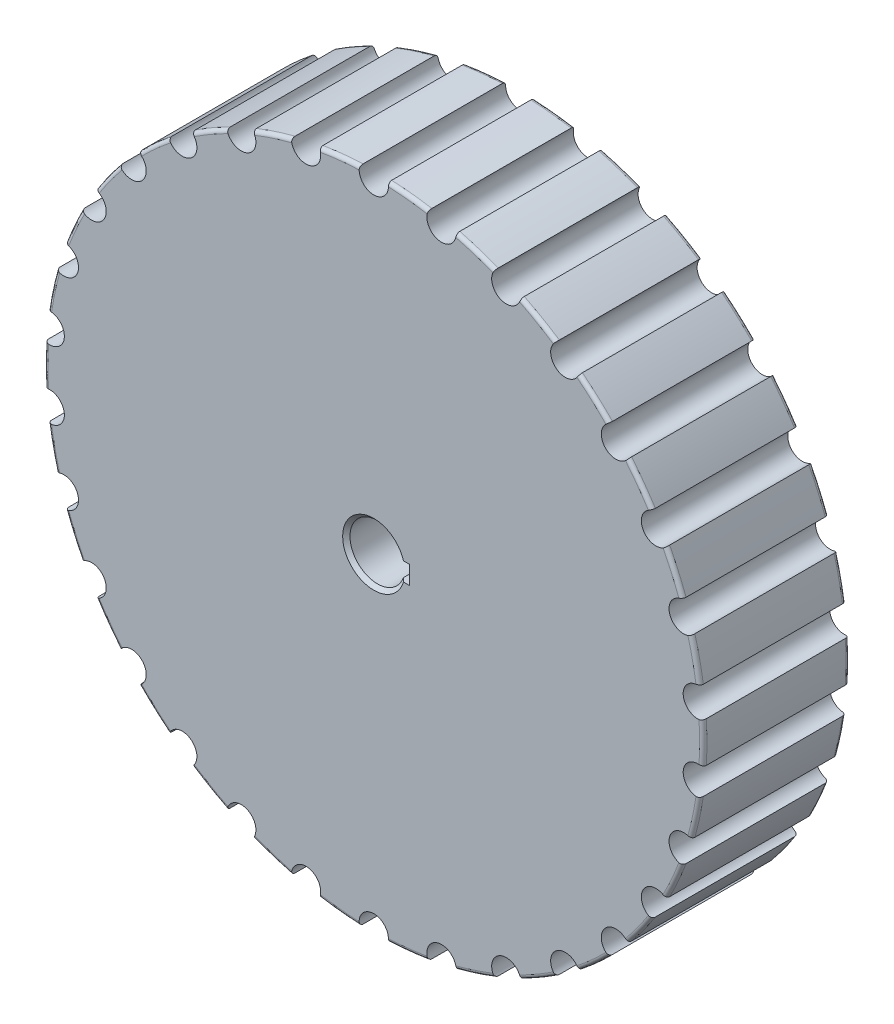
from build123d import *

# Parameters (mm, degrees)
SKETCH_1_W                  = 90
SKETCH_1_H                  = 40
HOLE_WIZARD_1_D             = 150
HOLE_WIZARD_1_DEPTH         = 16
SKETCH_4_R                  = 30
EXTRUDE_1_DEPTH             = 16
CUT_EXTRUDE_1_DEPTH         = 28
HOLE_WIZARD_8_0_8_1_D       = 8
HOLE_WIZARD_8_0_8_2_D       = 8
HOLE_WIZARD_3_3_3_3_1_D     = 3.3
HOLE_WIZARD_3_3_3_3_1_DEPTH = 4
CHAMFER_1_SIZE2             = 0.999999017
CHAMFER_1_SIZE              = 0.999998949
FILLET_1_R                  = 1


with BuildPart() as part:
    # 草图1 → 旋转1 (revolve)
    with BuildSketch(Plane(origin=(0, 0, 0), x_dir=(1, 0, 0), z_dir=(0, 1, 0))):
        with Locations((45, 0)):
            Rectangle(SKETCH_1_W, SKETCH_1_H)
    revolve(axis=Axis((0, 0, -20), (0, 0, 1)))

    # 孔1
    with Locations(Plane(origin=(0, 0, -20), x_dir=(-1, 0, 0), z_dir=(0, 0, -1))):
        with Locations((0, 0)):
            Hole(HOLE_WIZARD_1_D / 2, depth=HOLE_WIZARD_1_DEPTH)

    # 草图4 → 凸台-拉伸1 (add)
    with BuildSketch(Plane(origin=(0, 0, -4), x_dir=(-1, 0, 0), z_dir=(0, 0, -1))):
        with Locations(Location((0, 0, 0), (0, 0, 180))):
            Circle(SKETCH_4_R)
    extrude(amount=EXTRUDE_1_DEPTH)

    # 草图5 → 切除-拉伸1 (cut)
    with BuildSketch(Plane.XY.offset(20)):
        with BuildLine():
            Line((9.8, -2.5), (9.8, 2.5))
            Line((9.8, 2.5), (7.071067812, 2.5))
            ThreePointArc((7.071067812, 2.5), (7.5, 0), (7.071067812, -2.5))
            Line((7.071067812, -2.5), (9.8, -2.5))
        make_face()
    extrude(amount=-CUT_EXTRUDE_1_DEPTH, mode=Mode.SUBTRACT)

    # 草图6 → 切除-旋转1 (revolve, cut)
    with BuildSketch(Plane.XZ, mode=Mode.PRIVATE) as cut_revolve_1_sk:
        Polygon((7.5, 20), (0, 20), (0, -20), (25.5, -20), (25.5, -8), (7.5, -8), align=None)
    revolve(cut_revolve_1_sk.sketch.rotate(Axis((0, 0, 20), (0, 0, -1)), 180), axis=Axis((0, 0, 20), (0, 0, -1)), mode=Mode.SUBTRACT)

    # Ø8.0 (8) 直径孔1 (through all)
    with Locations(Plane(origin=(0, 0, -20), x_dir=(-1, 0, 0), z_dir=(0, 0, -1))):
        with Locations((-36.199561234, -81.30554573), (-52.312887454, -72.002512499), (-66.139889467, -59.552623966), (-77.076260937, -44.5), (-84.64402995, -27.502512499), (-84.64402995, 27.502512499), (-18.504140483, 87.055136465), (0, 89), (18.504140483, 87.055136465), (36.199561234, 81.30554573), (52.312887454, 72.002512499), (66.139889467, 59.552623966), (77.076260937, 44.5), (84.64402995, 27.502512499), (88.512448688, 9.303033231), (88.512448688, -9.303033231), (84.64402995, -27.502512499), (77.076260937, -44.5), (66.139889467, -59.552623966), (52.312887454, -72.002512499), (36.199561234, -81.30554573), (18.504140483, -87.055136465), (0, -89), (-18.504140483, -87.055136465)):
            Hole(HOLE_WIZARD_8_0_8_1_D / 2)

    # Ø8.0 (8) 直径孔2 (through all)
    with Locations(Plane.XY.offset(20)):
        with Locations((36.199561234, 81.30554573), (88.512448688, -9.303033231), (88.512448688, 9.303033231), (77.076260937, 44.5), (66.139889467, 59.552623966), (52.312887454, 72.002512499)):
            Hole(HOLE_WIZARD_8_0_8_2_D / 2)

    # Ø3.3 (3.3) 直径孔1
    with Locations(Plane(origin=(0, 0, -8), x_dir=(-1, 0, 0), z_dir=(0, 0, -1))):
        with Locations((20, 0), (0, 20), (-20, 0), (0, -20)):
            Hole(HOLE_WIZARD_3_3_3_3_1_D / 2, depth=HOLE_WIZARD_3_3_3_3_1_DEPTH)

    # 倒角1
    chamfer_1_edges = [part.edges().sort_by_distance(p)[0] for p in [
        (-7.5, 0, -8),
        (-7.5, 0, 20),
    ]]
    chamfer(chamfer_1_edges, length=CHAMFER_1_SIZE, length2=CHAMFER_1_SIZE2)

    # 圆角1
    fillet_1_edges = [part.edges().sort_by_distance(p)[0] for p in [
        (-27.811529494, -85.595086466, -20),
        (-27.811529494, -85.595086466, 20),
        (-45, -77.94228634, -20),
        (-45, -77.94228634, 20),
        (-60.221754572, -66.883034293, -20),
        (-60.221754572, -66.883034293, 20),
        (-72.811529494, -52.900672706, -20),
        (-72.811529494, -52.900672706, 20),
        (-82.219091188, -36.606297877, -20),
        (-82.219091188, -36.606297877, 20),
        (-88.033284066, -18.712052174, -20),
        (-88.033284066, -18.712052174, 20),
        (-90, 0, -20),
        (-90, 0, 20),
        (-88.033284066, 18.712052174, -20),
        (-88.033284066, 18.712052174, 20),
        (-82.219091188, 36.606297877, -20),
        (-82.219091188, 36.606297877, 20),
        (-72.811529494, 52.900672706, -20),
        (-72.811529494, 52.900672706, 20),
        (-60.221754572, 66.883034293, -20),
        (-60.221754572, 66.883034293, 20),
        (-45, 77.94228634, -20),
        (-45, 77.94228634, 20),
        (-27.811529494, 85.595086466, -20),
        (-27.811529494, 85.595086466, 20),
        (-9.407561694, 89.506970583, -20),
        (-9.407561694, 89.506970583, 20),
        (9.407561694, 89.506970583, -20),
        (9.407561694, 89.506970583, 20),
        (82.219091188, 36.606297877, -20),
        (82.219091188, 36.606297877, 20),
        (88.033284066, -18.712052174, -20),
        (88.033284066, -18.712052174, 20),
        (82.219091188, -36.606297877, -20),
        (82.219091188, -36.606297877, 20),
        (72.811529494, -52.900672706, -20),
        (72.811529494, -52.900672706, 20),
        (60.221754572, -66.883034293, -20),
        (60.221754572, -66.883034293, 20),
        (45, -77.94228634, -20),
        (45, -77.94228634, 20),
        (45, 77.94228634, -20),
        (45, 77.94228634, 20),
        (60.221754572, 66.883034293, -20),
        (60.221754572, 66.883034293, 20),
        (27.811529494, -85.595086466, 20),
        (72.811529494, 52.900672706, -20),
        (72.811529494, 52.900672706, 20),
        (88.033284066, 18.712052174, -20),
        (88.033284066, 18.712052174, 20),
        (90, 0, 20),
        (90, 0, -20),
        (27.811529494, -85.595086466, -20),
        (27.811529494, 85.595086466, 20),
        (27.811529494, 85.595086466, -20),
        (9.407561694, -89.506970583, 20),
        (9.407561694, -89.506970583, -20),
        (-9.407561694, -89.506970583, 20),
        (-9.407561694, -89.506970583, -20),
    ]]
    fillet(fillet_1_edges, radius=FILLET_1_R)


solid = part.part
